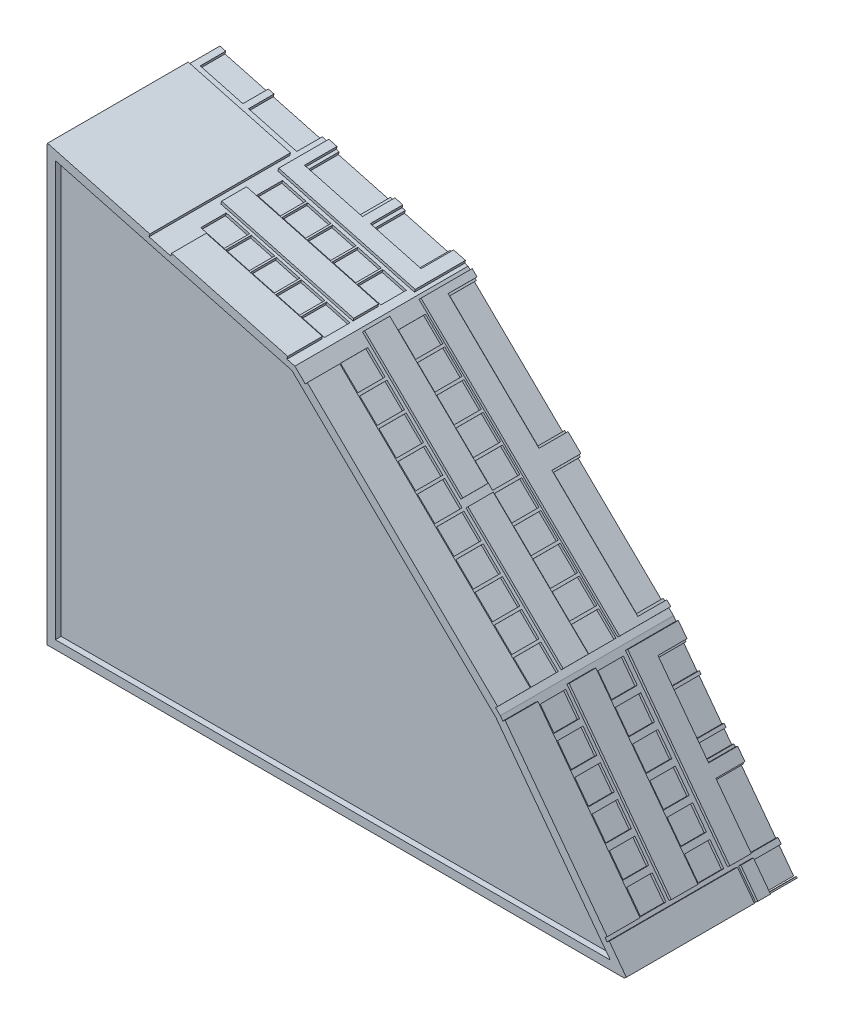
from build123d import *

# Parameters (mm, degrees)
BOSS_EXTRUDE1_DEPTH = 60
SKETCH2_W           = 11.363922746
SKETCH2_H           = 58.998427592
SKETCH2_W_2         = 44.372628641
SKETCH2_H_2         = 9.8579631
SKETCH2_W_3         = 9.250719112
SKETCH2_W_4         = 7.449365752
SKETCH2_W_5         = 4.369696961
SKETCH2_W_6         = 10.063641163
SKETCH2_H_3         = 4.213378673
SKETCH2_H_4         = 4.991998115
BOSS_EXTRUDE2_DEPTH = 1
SKETCH3_W           = 8.822391574
SKETCH3_H           = 8
SKETCH3_W_2         = 9.355933485
SKETCH3_H_2         = 8.829225599
SKETCH3_H_3         = 20
SKETCH3_H_4         = 4.500461924
SKETCH3_H_5         = 13.347682381
SKETCH3_H_6         = 7.841104857
CUT_EXTRUDE1_DEPTH  = 1
SKETCH4_W           = 92.032783943
SKETCH4_H           = 11.257896243
SKETCH4_W_2         = 46.016391972
SKETCH4_H_2         = 8.736875913
SKETCH4_W_3         = 47.509583016
SKETCH4_W_4         = 96.032073798
SKETCH4_H_3         = 7.688695296
SKETCH4_W_5         = 6.25340811
SKETCH4_H_4         = 10.03940411
SKETCH4_W_6         = 1.932204442
SKETCH4_W_7         = 2.367539759
BOSS_EXTRUDE3_DEPTH = 1
SKETCH5_W           = 8.4
SKETCH5_H           = 9.447951635
SKETCH5_W_2         = 40.134399874
SKETCH5_H_2         = 9.257599233
SKETCH5_W_3         = 42.647608076
CUT_EXTRUDE2_DEPTH  = 1
SKETCH6_W           = 41.673969621
SKETCH6_H           = 12.012274036
SKETCH6_W_2         = 47.365810967
SKETCH6_H_2         = 8.643736871
SKETCH6_W_3         = 36.704999651
SKETCH6_H_3         = 48.734569283
BOSS_EXTRUDE4_DEPTH = 1
SKETCH7_W           = 8.4
SKETCH7_H           = 8.828427303
SKETCH7_W_2         = 16.093824115
SKETCH7_H_2         = 10.511500051
SKETCH7_W_3         = 18.401388078
SKETCH7_W_4         = 17.302315574
SKETCH7_H_3         = 8.837824906
SKETCH7_W_5         = 15.291513377
CUT_EXTRUDE3_DEPTH  = 1
CUT_EXTRUDE4_DEPTH  = 2
CUT_EXTRUDE5_DEPTH  = 55


with BuildPart() as part:
    # Sketch1 → Boss-Extrude1 (new body)
    with BuildSketch(Plane.XY):
        Polygon((157.125238479, 57.275821924), (200, 0), (0, 0), (0, 149.629502652), (85.949499286, 126.549420637), align=None)
    extrude(amount=-BOSS_EXTRUDE1_DEPTH)

    # Sketch2 → Boss-Extrude2 (add)
    with BuildSketch(Plane(origin=(128.176222486, 95.94842618, 0), x_dir=(0, 0, -1), z_dir=(0.8005505058567911, 0.5992652898111452, 0))):
        with Locations((5.681961373, -79.277584325)):
            Rectangle(SKETCH2_W, SKETCH2_H)
        with Locations((22.186314321, -114.924076412)):
            Rectangle(SKETCH2_W_2, SKETCH2_H_2)
        with Locations((26.811673876, -79.277584325)):
            Rectangle(SKETCH2_W_3, SKETCH2_H)
        with Locations((46.211675961, -79.277584325)):
            Rectangle(SKETCH2_W_4, SKETCH2_H)
        with Locations((47.751510357, -114.924076412)):
            Rectangle(SKETCH2_W_5, SKETCH2_H_2)
        with Locations((54.968179419, -86.186974998)):
            Rectangle(SKETCH2_W_6, SKETCH2_H_3)
        with Locations((54.968179419, -52.274369587)):
            Rectangle(SKETCH2_W_6, SKETCH2_H_4)
    extrude(amount=BOSS_EXTRUDE2_DEPTH)

    # Sketch3 → Cut-Extrude1 (cut)
    with BuildSketch(Plane(origin=(128.176222486, 95.94842618, 0), x_dir=(0, 0, -1), z_dir=(0.8005505058567911, 0.5992652898111452, 0))):
        with Locations((16.775118533, -104.767497778)):
            Rectangle(SKETCH3_W, SKETCH3_H)
        with Locations((36.775118533, -104.767497778)):
            Rectangle(SKETCH3_W, SKETCH3_H)
        with Locations((36.775118533, -94.767497778)):
            Rectangle(SKETCH3_W, SKETCH3_H)
        with Locations((36.775118533, -84.767497778)):
            Rectangle(SKETCH3_W, SKETCH3_H)
        with Locations((36.775118533, -74.767497778)):
            Rectangle(SKETCH3_W, SKETCH3_H)
        with Locations((36.775118533, -64.767497778)):
            Rectangle(SKETCH3_W, SKETCH3_H)
        with Locations((36.775118533, -54.767497778)):
            Rectangle(SKETCH3_W, SKETCH3_H)
        with Locations((16.775118533, -94.767497778)):
            Rectangle(SKETCH3_W, SKETCH3_H)
        with Locations((16.775118533, -84.767497778)):
            Rectangle(SKETCH3_W, SKETCH3_H)
        with Locations((16.775118533, -74.767497778)):
            Rectangle(SKETCH3_W, SKETCH3_H)
        with Locations((16.775118533, -64.767497778)):
            Rectangle(SKETCH3_W, SKETCH3_H)
        with Locations((16.775118533, -54.767497778)):
            Rectangle(SKETCH3_W, SKETCH3_H)
        with Locations((55.322033258, -115.003963255)):
            Rectangle(SKETCH3_W_2, SKETCH3_H_2)
        with Locations((55.322033258, -98.767497778)):
            Rectangle(SKETCH3_W_2, SKETCH3_H_3)
        with Locations((55.322033258, -81.01772874)):
            Rectangle(SKETCH3_W_2, SKETCH3_H_4)
        with Locations((55.322033258, -70.946346694)):
            Rectangle(SKETCH3_W_2, SKETCH3_H_5)
        with Locations((55.322033258, -59.365218227)):
            Rectangle(SKETCH3_W_2, SKETCH3_H_6)
    extrude(amount=-CUT_EXTRUDE1_DEPTH, mode=Mode.SUBTRACT)

    # Sketch4 → Boss-Extrude3 (add)
    with BuildSketch(Plane(origin=(105.062430493, 107.947274151, 0), x_dir=(0.7166175871730553, -0.6974662957837235, 0), z_dir=(0.6974662957837235, 0.7166175871730553, 0))):
        with Locations((24.379912441, 5.628948122)):
            Rectangle(SKETCH4_W, SKETCH4_H)
        with Locations((47.388108426, 27.074285835)):
            Rectangle(SKETCH4_W_2, SKETCH4_H_2)
        with Locations((-1.880977878, 27.074285835)):
            Rectangle(SKETCH4_W_3, SKETCH4_H_2)
        with Locations((22.380267513, 46.116248242)):
            Rectangle(SKETCH4_W_4, SKETCH4_H_3)
        with Locations((23.811003614, 54.980297945)):
            Rectangle(SKETCH4_W_5, SKETCH4_H_4)
        with Locations((69.430202191, 54.980297945)):
            Rectangle(SKETCH4_W_6, SKETCH4_H_4)
        with Locations((-24.451999507, 54.980297945)):
            Rectangle(SKETCH4_W_7, SKETCH4_H_4)
    extrude(amount=BOSS_EXTRUDE3_DEPTH)

    # Sketch5 → Cut-Extrude2 (cut)
    with BuildSketch(Plane(origin=(105.062430493, 107.947274151, 0), x_dir=(0.7166175871730553, -0.6974662957837235, 0), z_dir=(0.6974662957837235, 0.7166175871730553, 0))):
        with Locations((66.196304412, 16.981872061)):
            Rectangle(SKETCH5_W, SKETCH5_H)
        with Locations((56.896304412, 16.981872061)):
            Rectangle(SKETCH5_W, SKETCH5_H)
        with Locations((47.596304412, 16.981872061)):
            Rectangle(SKETCH5_W, SKETCH5_H)
        with Locations((38.296304412, 16.981872061)):
            Rectangle(SKETCH5_W, SKETCH5_H)
        with Locations((28.996304412, 16.981872061)):
            Rectangle(SKETCH5_W, SKETCH5_H)
        with Locations((19.696304412, 16.981872061)):
            Rectangle(SKETCH5_W, SKETCH5_H)
        with Locations((10.396304412, 16.981872061)):
            Rectangle(SKETCH5_W, SKETCH5_H)
        with Locations((1.096304412, 16.981872061)):
            Rectangle(SKETCH5_W, SKETCH5_H)
        with Locations((-8.203695588, 16.981872061)):
            Rectangle(SKETCH5_W, SKETCH5_H)
        with Locations((-17.503695588, 16.981872061)):
            Rectangle(SKETCH5_W, SKETCH5_H)
        with Locations((56.896304412, 36.981872061)):
            Rectangle(SKETCH5_W, SKETCH5_H)
        with Locations((47.596304412, 36.981872061)):
            Rectangle(SKETCH5_W, SKETCH5_H)
        with Locations((38.296304412, 36.981872061)):
            Rectangle(SKETCH5_W, SKETCH5_H)
        with Locations((28.996304412, 36.981872061)):
            Rectangle(SKETCH5_W, SKETCH5_H)
        with Locations((19.696304412, 36.981872061)):
            Rectangle(SKETCH5_W, SKETCH5_H)
        with Locations((10.396304412, 36.981872061)):
            Rectangle(SKETCH5_W, SKETCH5_H)
        with Locations((1.096304412, 36.981872061)):
            Rectangle(SKETCH5_W, SKETCH5_H)
        with Locations((-8.203695588, 36.981872061)):
            Rectangle(SKETCH5_W, SKETCH5_H)
        with Locations((-17.503695588, 36.981872061)):
            Rectangle(SKETCH5_W, SKETCH5_H)
        with Locations((66.196304412, 36.981872061)):
            Rectangle(SKETCH5_W, SKETCH5_H)
        with Locations((47.625009786, 55.371200384)):
            Rectangle(SKETCH5_W_2, SKETCH5_H_2)
        with Locations((-1.291927699, 55.371200384)):
            Rectangle(SKETCH5_W_3, SKETCH5_H_2)
    extrude(amount=-CUT_EXTRUDE2_DEPTH, mode=Mode.SUBTRACT)

    # Sketch6 → Boss-Extrude4 (add)
    with BuildSketch(Plane(origin=(37.477653093, 139.565601008, 0), x_dir=(0.9657852733998299, -0.2593430270587894, 0), z_dir=(0.25934302705878937, 0.9657852733998298, 0))):
        with Locations((26.528826157, 6.006137018)):
            Rectangle(SKETCH6_W, SKETCH6_H)
        with Locations((23.682905484, 27.162569774)):
            Rectangle(SKETCH6_W_2, SKETCH6_H_2)
        with Locations((-20.45286833, 24.367284642)):
            Rectangle(SKETCH6_W_3, SKETCH6_H_3)
        Polygon((2.922940378, 60), (0, 60), (0, 42.597438783), (48.99019297, 42.597438783), (48.99019297, 60), (44.725041665, 60), (44.725041665, 48.734569283), (26.528826156, 48.734569283), (26.528826156, 60), (23.682905484, 60), (23.682905484, 48.734569283), (2.922940378, 48.734569283), align=None)
    extrude(amount=BOSS_EXTRUDE4_DEPTH)

    # Sketch7 → Cut-Extrude3 (cut)
    with BuildSketch(Plane(origin=(37.477653093, 139.565601008, 0), x_dir=(0.9657852733998299, -0.2593430270587894, 0), z_dir=(0.25934302705878937, 0.9657852733998298, 0))):
        with Locations((43.165810967, 17.426487687)):
            Rectangle(SKETCH7_W, SKETCH7_H)
        with Locations((34.165810967, 17.426487687)):
            Rectangle(SKETCH7_W, SKETCH7_H)
        with Locations((25.165810967, 17.426487687)):
            Rectangle(SKETCH7_W, SKETCH7_H)
        with Locations((16.165810967, 17.426487687)):
            Rectangle(SKETCH7_W, SKETCH7_H)
        with Locations((7.165810967, 17.426487687)):
            Rectangle(SKETCH7_W, SKETCH7_H)
        with Locations((34.165810967, 36.926487687)):
            Rectangle(SKETCH7_W, SKETCH7_H)
        with Locations((25.165810967, 36.926487687)):
            Rectangle(SKETCH7_W, SKETCH7_H)
        with Locations((16.165810967, 36.926487687)):
            Rectangle(SKETCH7_W, SKETCH7_H)
        with Locations((7.165810967, 36.926487687)):
            Rectangle(SKETCH7_W, SKETCH7_H)
        with Locations((43.165810967, 36.926487687)):
            Rectangle(SKETCH7_W, SKETCH7_H)
        with Locations((35.739117742, 54.744249975)):
            Rectangle(SKETCH7_W_2, SKETCH7_H_2)
        with Locations((13.156314181, 54.744249975)):
            Rectangle(SKETCH7_W_3, SKETCH7_H_2)
        with Locations((-10.751526291, 55.581087547)):
            Rectangle(SKETCH7_W_4, SKETCH7_H_3)
        with Locations((-29.078500965, 55.581087547)):
            Rectangle(SKETCH7_W_5, SKETCH7_H_3)
    extrude(amount=-CUT_EXTRUDE3_DEPTH, mode=Mode.SUBTRACT)

    # Sketch8 → Cut-Extrude4 (cut)
    with BuildSketch(Plane.XY):
        Polygon((3, 146.753056761), (3, 3), (195.256019649, 3), (155.618028481, 55.951863591), (84.927802912, 124.75292382), align=None)
    extrude(amount=-CUT_EXTRUDE4_DEPTH, mode=Mode.SUBTRACT)

    # Sketch9 → Cut-Extrude5 (cut)
    with BuildSketch(Plane(origin=(0, 0, -60), x_dir=(-1, 0, 0), z_dir=(0, 0, -1))):
        Polygon((-3, 145.717629914), (-3, 3), (-194.006879223, 3), (-154.864423483, 55.289884424), (-84.416954724, 123.854675411), align=None)
    extrude(amount=-CUT_EXTRUDE5_DEPTH, mode=Mode.SUBTRACT)


solid = part.part
